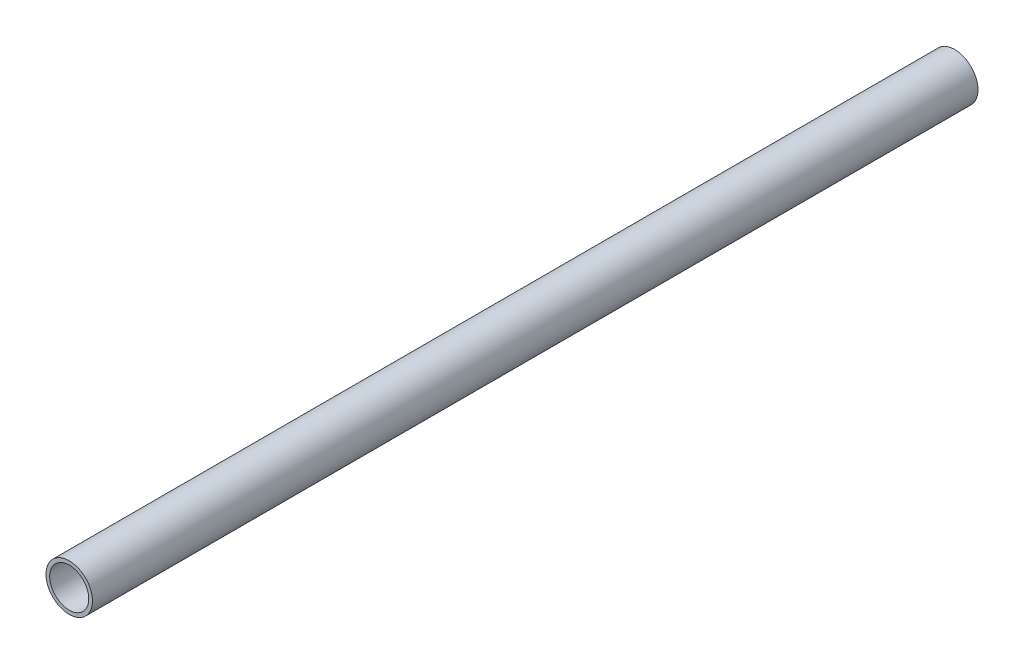
from build123d import *

# Parameters (mm, degrees)
CROQUIS1_R              = 12.5
CROQUIS1_R_2            = 10.5
SALIENTE_EXTRUIR1_DEPTH = 476


with BuildPart() as part:
    # Croquis1 → Saliente-Extruir1 (new body)
    with BuildSketch(Plane.XY):
        Circle(CROQUIS1_R)
        Circle(CROQUIS1_R_2, mode=Mode.SUBTRACT)
    extrude(amount=SALIENTE_EXTRUIR1_DEPTH)


solid = part.part
